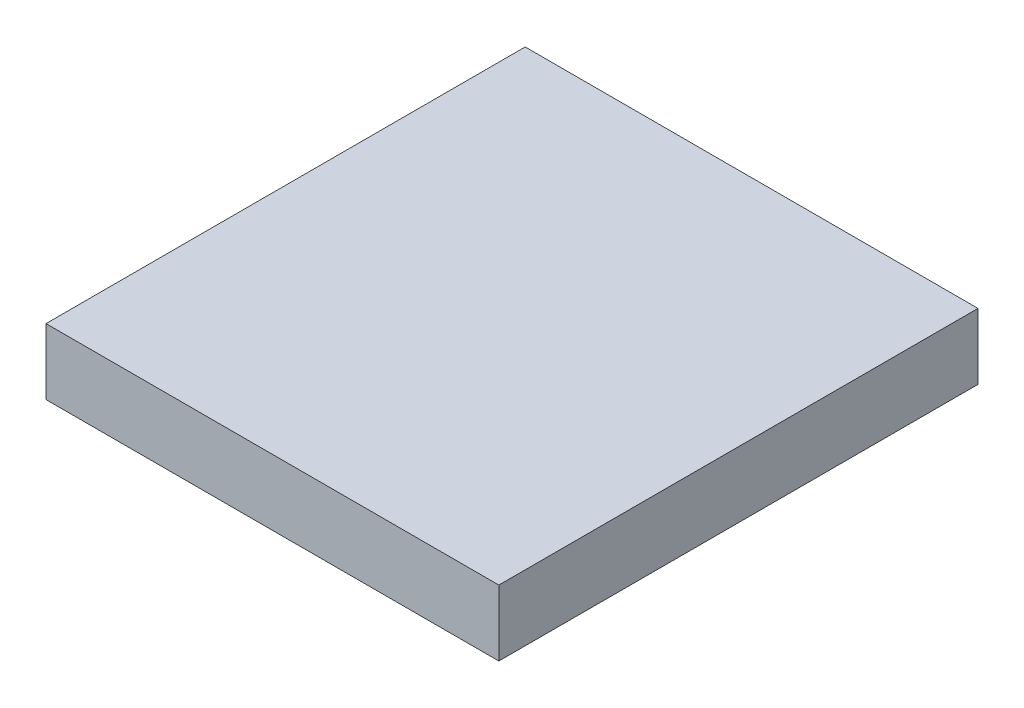
from build123d import *

# Parameters (mm, degrees)
SKETCH2_W           = 172
SKETCH2_H           = 182
BOSS_EXTRUDE1_DEPTH = 25


with BuildPart() as part:
    # Sketch2 → Boss-Extrude1 (new body)
    with BuildSketch(Plane(origin=(0, 0, 0), x_dir=(1, 0, 0), z_dir=(0, 1, 0))):
        with Locations((86, -171)):
            Rectangle(SKETCH2_W, SKETCH2_H)
    extrude(amount=-BOSS_EXTRUDE1_DEPTH)


solid = part.part
